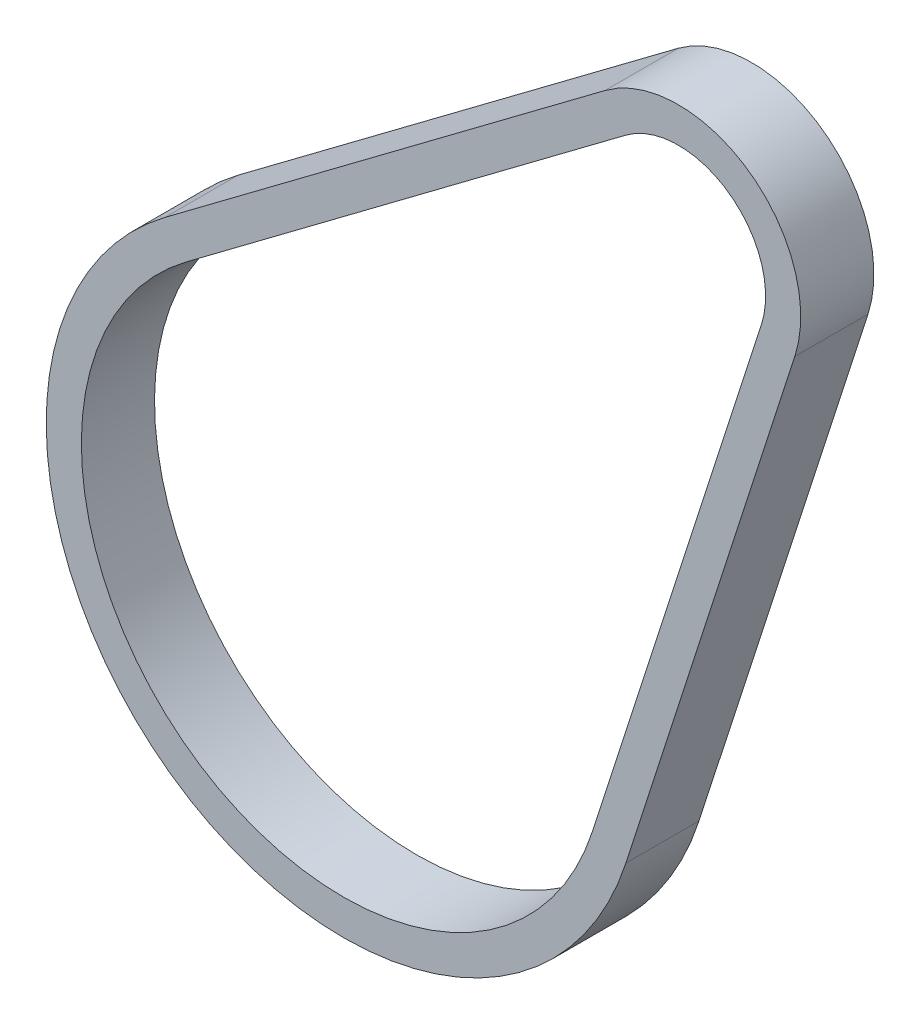
from build123d import *

# Parameters (mm, degrees)
EXTRUDE_THIN1_DEPTH = 5


with BuildPart() as part:
    # Sketch2 → Extrude-Thin1 (new body)
    with BuildSketch(Plane.XY):
        with BuildLine():
            Line((-12.17628342, 16.241028502), (17.890689996, 38.782950022))
            ThreePointArc((17.890689996, 38.782950022), (27.764668676, 38.8985576), (30.864072766, 29.522923522))
            Line((30.864072766, 29.522923522), (19.31645598, -6.237580709))
            ThreePointArc((19.31645598, -6.237580709), (-11.792687737, -16.521664585), (-12.17628342, 16.241028502))
        make_face()
        with BuildLine():
            Line((-10.736623047, 14.320773828), (19.330350369, 36.862695349))
            ThreePointArc((19.330350369, 36.862695349), (26.370362661, 36.945121977), (28.580195555, 30.260422597))
            Line((28.580195555, 30.260422597), (17.032578769, -5.500081633))
            ThreePointArc((17.032578769, -5.500081633), (-10.398381721, -14.568228962), (-10.736623047, 14.320773828))
        make_face(mode=Mode.SUBTRACT)
    extrude(amount=-EXTRUDE_THIN1_DEPTH)


solid = part.part
